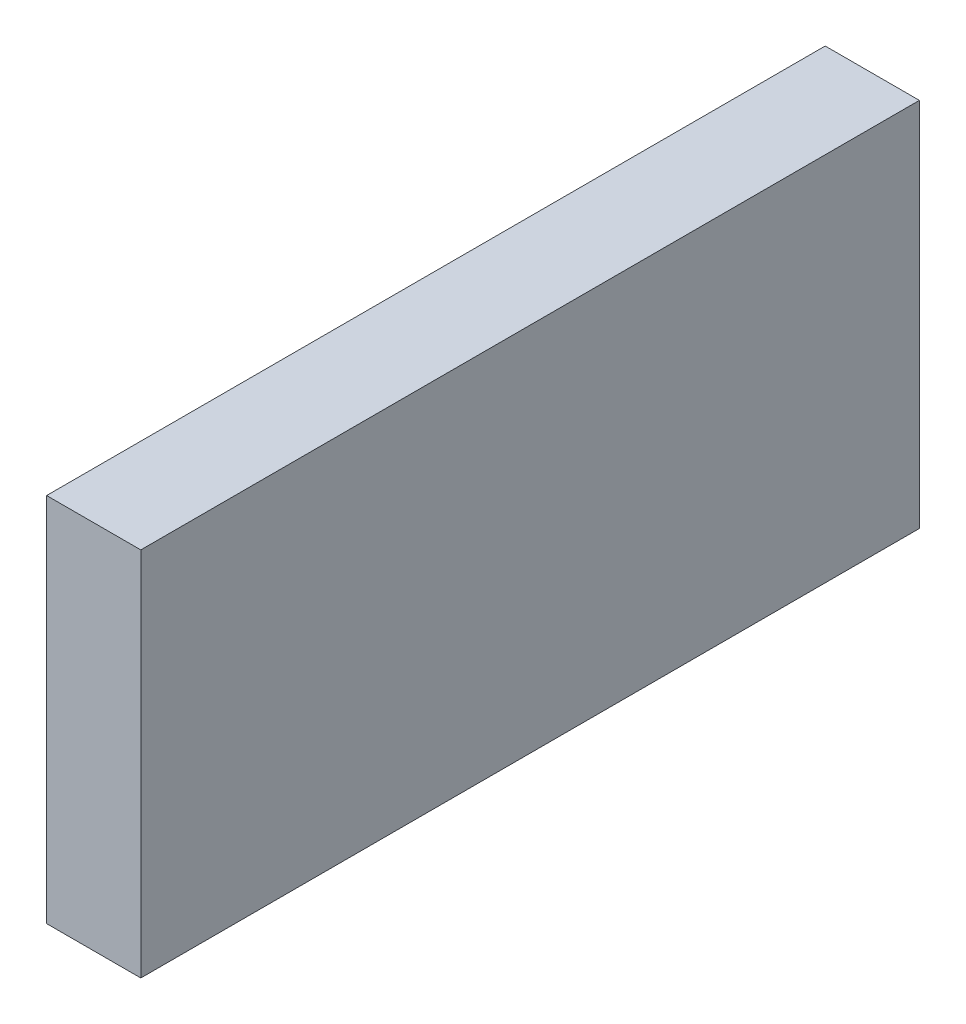
from build123d import *

# Parameters (mm, degrees)
SKETCH1_W           = 42
SKETCH1_H           = 20
BOSS_EXTRUDE1_DEPTH = 5.08


with BuildPart() as part:
    # Sketch1 → Boss-Extrude1 (new body)
    with BuildSketch(Plane(origin=(0, 0, 0), x_dir=(0, 0, -1), z_dir=(1, 0, 0))):
        with Locations((-9.589122013, 8.206945201)):
            Rectangle(SKETCH1_W, SKETCH1_H)
    extrude(amount=BOSS_EXTRUDE1_DEPTH)


solid = part.part
